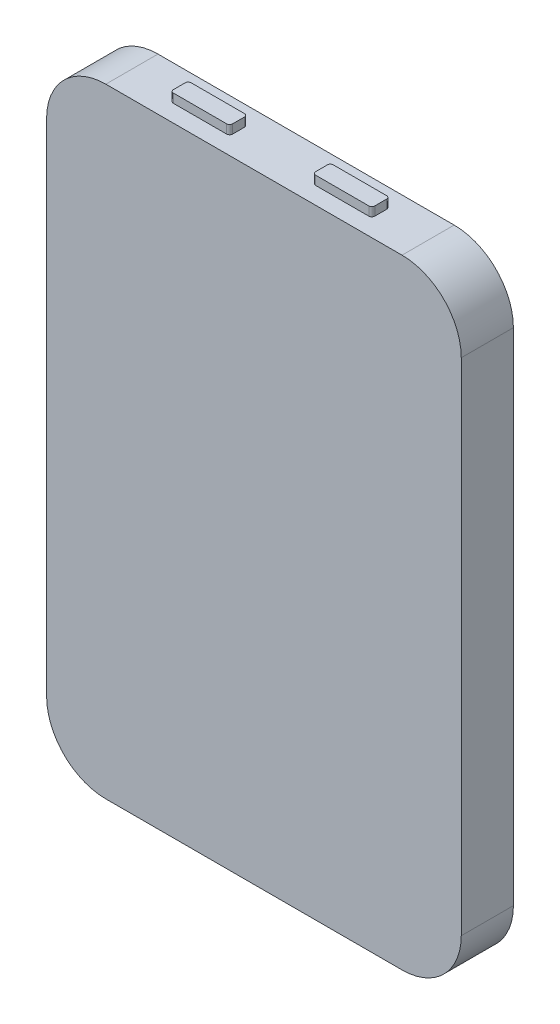
from build123d import *

# Parameters (mm, degrees)
EXTRUDE_1_DEPTH     = 8.8
EXTRUDE_2_DEPTH     = 1.5
SKETCH_3_R          = 0.5
SKETCH_3_R_2        = 0.502704905
CUT_EXTRUDE_1_DEPTH = 0.1


with BuildPart() as part:
    # 草圖1 → 填料-伸長1 (new body)
    with BuildSketch(Plane.XY):
        with BuildLine():
            Line((-25, -52.25), (25, -52.25))
            ThreePointArc((25, -52.25), (32.071067812, -49.321067812), (35, -42.25))
            Line((35, -42.25), (35, 42.25))
            ThreePointArc((35, 42.25), (32.071067812, 49.321067812), (25, 52.25))
            Line((25, 52.25), (-25, 52.25))
            ThreePointArc((-25, 52.25), (-32.071067812, 49.321067812), (-35, 42.25))
            Line((-35, 42.25), (-35, -42.25))
            ThreePointArc((-35, -42.25), (-32.071067812, -49.321067812), (-25, -52.25))
        make_face()
    extrude(amount=EXTRUDE_1_DEPTH)

    # 草圖2 → 填料-伸長2 (add)
    with BuildSketch(Plane(origin=(0, 52.25, 0), x_dir=(1, 0, 0), z_dir=(0, 1, 0))):
        with BuildLine():
            Line((-16.5, -5.9), (-7.5, -5.9))
            ThreePointArc((-7.5, -5.9), (-7.146446609, -5.753553391), (-7, -5.4))
            Line((-7, -5.4), (-7, -3.4))
            ThreePointArc((-7, -3.4), (-7.146446609, -3.046446609), (-7.5, -2.9))
            Line((-7.5, -2.9), (-16.5, -2.9))
            ThreePointArc((-16.5, -2.9), (-16.853553391, -3.046446609), (-17, -3.4))
            Line((-17, -3.4), (-17, -5.4))
            ThreePointArc((-17, -5.4), (-16.853553391, -5.753553391), (-16.5, -5.9))
        make_face()
        with BuildLine():
            Line((7.5, -5.9), (16.5, -5.9))
            ThreePointArc((16.5, -5.9), (16.853553391, -5.753553391), (17, -5.4))
            Line((17, -5.4), (17, -3.4))
            ThreePointArc((17, -3.4), (16.853553391, -3.046446609), (16.5, -2.9))
            Line((16.5, -2.9), (7.5, -2.9))
            ThreePointArc((7.5, -2.9), (7.146446609, -3.046446609), (7, -3.4))
            Line((7, -3.4), (7, -5.4))
            ThreePointArc((7, -5.4), (7.146446609, -5.753553391), (7.5, -5.9))
        make_face()
    extrude(amount=EXTRUDE_2_DEPTH)

    # 草圖3 → 除料-伸長1 (cut)
    with BuildSketch(Plane(origin=(0, 0, 0), x_dir=(-1, 0, 0), z_dir=(0, 0, -1))):
        with Locations((0, 48.370695597)):
            Circle(SKETCH_3_R)
        with Locations((-2, 48.370695597)):
            Circle(SKETCH_3_R_2)
        with Locations((4, 48.370695597)):
            Circle(SKETCH_3_R)
        with Locations((2, 48.370695597)):
            Circle(SKETCH_3_R_2)
        with Locations((-4, 48.370695597)):
            Circle(SKETCH_3_R_2)
    extrude(amount=-CUT_EXTRUDE_1_DEPTH, mode=Mode.SUBTRACT)


solid = part.part
